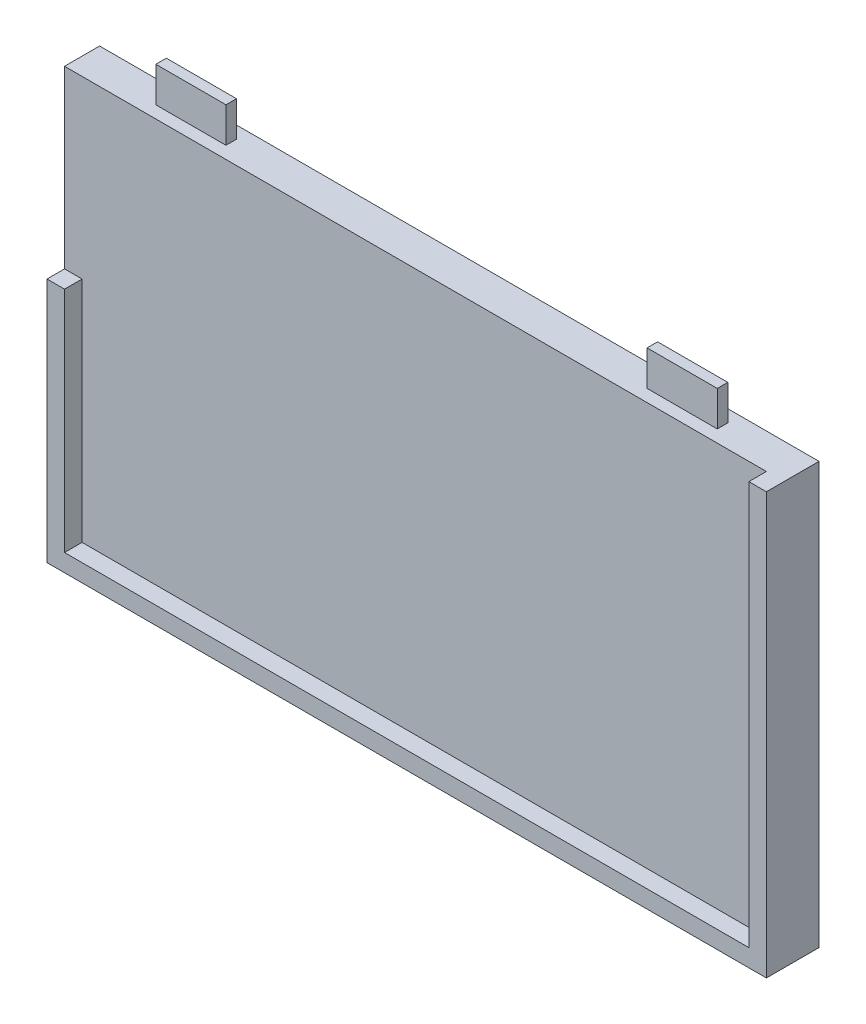
from build123d import *

# Parameters (mm, degrees)
SKETCH1_W           = 120
SKETCH1_H           = 205
BOSS_EXTRUDE1_DEPTH = 10
BOSS_EXTRUDE2_DEPTH = 5
SKETCH3_W           = 20.5
SKETCH3_H           = 3.2
CUT_EXTRUDE1_DEPTH  = 10
SKETCH4_W           = 20
SKETCH4_H           = 3
BOSS_EXTRUDE3_DEPTH = 10
SKETCH5_W           = 5.2
SKETCH5_H           = 3.2
CUT_EXTRUDE2_DEPTH  = 5


with BuildPart() as part:
    # Sketch1 → Boss-Extrude1 (new body)
    with BuildSketch(Plane(origin=(0, 0, 0), x_dir=(0, 1, 0), z_dir=(0, 0, 1))):
        Rectangle(SKETCH1_W, SKETCH1_H)
    extrude(amount=BOSS_EXTRUDE1_DEPTH)

    # Sketch2 → Boss-Extrude2 (add)
    with BuildSketch(Plane.XY.offset(10)):
        Polygon((-97.5, -55), (97.5, -55), (97.5, 60), (102.5, 60), (102.5, -60), (-102.5, -60), (-102.5, 10), (-97.5, 10), align=None)
    extrude(amount=BOSS_EXTRUDE2_DEPTH)

    # Sketch3 → Cut-Extrude1 (cut)
    with BuildSketch(Plane(origin=(-102.5, 0, 0), x_dir=(0, -1, 0), z_dir=(-1, 0, 0))):
        with Locations((-30, 5)):
            Rectangle(SKETCH3_W, SKETCH3_H)
    extrude(amount=-CUT_EXTRUDE1_DEPTH, mode=Mode.SUBTRACT)

    # Sketch4 → Boss-Extrude3 (add)
    with BuildSketch(Plane(origin=(0, 60, 0), x_dir=(-1, 0, 0), z_dir=(0, 1, 0))):
        with Locations((70, 5)):
            Rectangle(SKETCH4_W, SKETCH4_H)
        with Locations((-70, 5)):
            Rectangle(SKETCH4_W, SKETCH4_H)
    extrude(amount=BOSS_EXTRUDE3_DEPTH)

    # Sketch5 → Cut-Extrude2 (cut)
    with BuildSketch(Plane.XZ.offset(60)):
        with Locations((15, 1.6)):
            Rectangle(SKETCH5_W, SKETCH5_H)
        with Locations((-15, 1.6)):
            Rectangle(SKETCH5_W, SKETCH5_H)
    extrude(amount=-CUT_EXTRUDE2_DEPTH, mode=Mode.SUBTRACT)


solid = part.part
